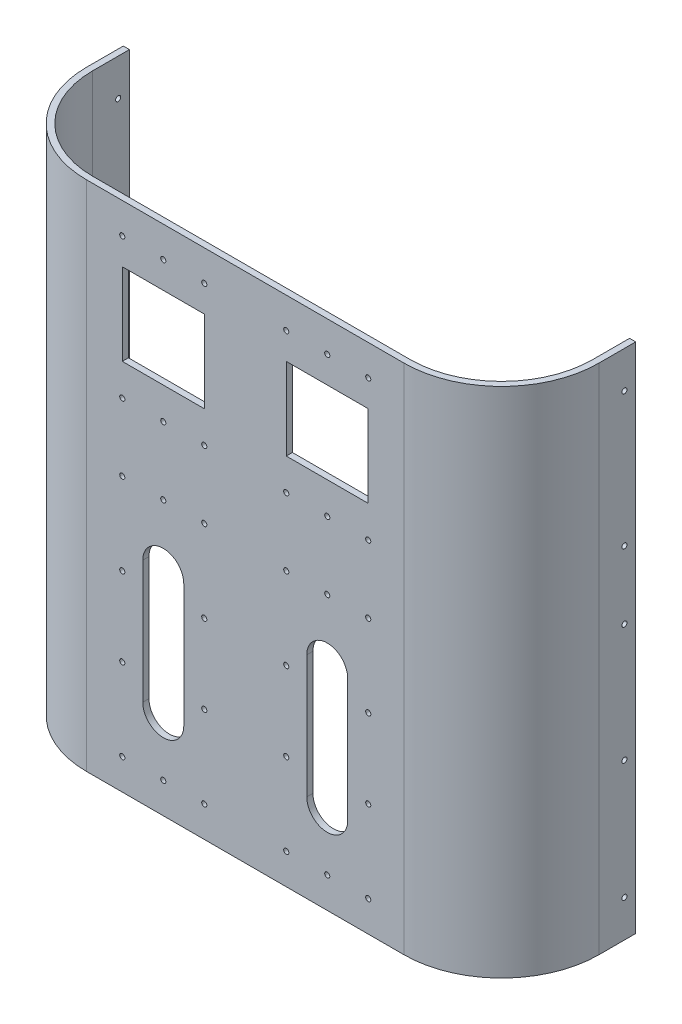
from build123d import *

# Parameters (mm, degrees)
SKETCH_1_W                  = 250
SKETCH_1_H                  = 250
EXTRUDE_1_DEPTH             = 65.5
SKETCH_2_W                  = 244
SKETCH_2_H                  = 62.5
CUT_EXTRUDE_1_DEPTH         = 286.161796179
SKETCH_3_W                  = 40
SKETCH_3_H                  = 40
CUT_EXTRUDE_2_DEPTH         = 287.410980935
CUT_EXTRUDE_3_DEPTH         = 287.410980935
SKETCH_5_W                  = 40
SKETCH_5_H                  = 40
CUT_EXTRUDE_4_DEPTH         = 287.410980935
CUT_EXTRUDE_5_DEPTH         = 288.080563605
HOLE_WIZARD_2_5_2_5_1_D     = 2.5
HOLE_WIZARD_2_5_2_5_2_D     = 2.5
HOLE_WIZARD_2_5_2_5_2_DEPTH = 3
HOLE_WIZARD_2_5_2_5_3_D     = 2.5
FILLET_1_R                  = 44.5
FILLET_2_R                  = 47.5


with BuildPart() as part:
    # Эскиз1 → Бобышка-Вытянуть1 (new body)
    with BuildSketch(Plane.XY.offset(56.5)):
        with Locations((0, 125)):
            Rectangle(SKETCH_1_W, SKETCH_1_H)
    extrude(amount=-EXTRUDE_1_DEPTH)

    # Эскиз2 → Вырез-Вытянуть1 (cut, through all)
    with BuildSketch(Plane.XZ):
        with Locations((0, 22.25)):
            Rectangle(SKETCH_2_W, SKETCH_2_H)
    extrude(amount=-CUT_EXTRUDE_1_DEPTH, mode=Mode.SUBTRACT)

    # Эскиз3 → Вырез-Вытянуть2 (cut, through all)
    with BuildSketch(Plane(origin=(0, 0, 53.5), x_dir=(-1, 0, 0), z_dir=(0, 0, -1))):
        with Locations((40, 202)):
            Rectangle(SKETCH_3_W, SKETCH_3_H)
    extrude(amount=-CUT_EXTRUDE_2_DEPTH, mode=Mode.SUBTRACT)

    # Эскиз4 → Вырез-Вытянуть3 (cut, through all)
    with BuildSketch(Plane(origin=(0, 0, 53.5), x_dir=(-1, 0, 0), z_dir=(0, 0, -1))):
        with BuildLine():
            Line((-50, 103), (-50, 43))
            ThreePointArc((-50, 43), (-40, 33), (-30, 43))
            Line((-30, 43), (-30, 103))
            ThreePointArc((-30, 103), (-40, 113), (-50, 103))
        make_face()
    extrude(amount=-CUT_EXTRUDE_3_DEPTH, mode=Mode.SUBTRACT)

    # Эскиз5 → Вырез-Вытянуть4 (cut, through all)
    with BuildSketch(Plane(origin=(0, 0, 53.5), x_dir=(-1, 0, 0), z_dir=(0, 0, -1))):
        with Locations((-40, 202)):
            Rectangle(SKETCH_5_W, SKETCH_5_H)
    extrude(amount=-CUT_EXTRUDE_4_DEPTH, mode=Mode.SUBTRACT)

    # Эскиз6 → Вырез-Вытянуть5 (cut, through all)
    with BuildSketch(Plane.XY.offset(56.5)):
        with BuildLine():
            Line((-30, 43), (-30, 103))
            ThreePointArc((-30, 103), (-40, 113), (-50, 103))
            Line((-50, 103), (-50, 43))
            ThreePointArc((-50, 43), (-40, 33), (-30, 43))
        make_face()
    extrude(amount=-CUT_EXTRUDE_5_DEPTH, mode=Mode.SUBTRACT)

    # Диаметр отверстия Ø2.5 (2.5)1 (through all)
    with Locations(Plane(origin=(0, 0, 53.5), x_dir=(-1, 0, 0), z_dir=(0, 0, -1))):
        with Locations((60, 166.5), (20, 235), (20, 166.5), (-20, 133.5), (-20, 15), (-40, 166.5), (-40, 15), (-60, 235), (-60, 166.5), (60, 55), (20, 93.5), (20, 55), (-20, 93.5), (-20, 55), (-60, 93.5), (-60, 55), (60, 93.5), (-60, 15), (-60, 133.5), (-40, 133.5), (-40, 235), (-20, 166.5), (-20, 235), (20, 15), (20, 133.5), (40, 15), (40, 133.5), (40, 166.5), (40, 235), (60, 15), (60, 133.5), (60, 235)):
            Hole(HOLE_WIZARD_2_5_2_5_1_D / 2)

    # Диаметр отверстия Ø2.5 (2.5)2
    with Locations(Plane.ZY.offset(-122)):
        with Locations((-3.5, 232), (-3.5, 18), (-3.5, 76), (-3.5, 133.5), (-3.5, 166.5)):
            Hole(HOLE_WIZARD_2_5_2_5_2_D / 2, depth=HOLE_WIZARD_2_5_2_5_2_DEPTH)

    # Диаметр отверстия Ø2.5 (2.5)3 (through all)
    with Locations(Plane(origin=(-122, 0, 0), x_dir=(0, 0, -1), z_dir=(1, 0, 0))):
        with Locations((3.5, 232), (3.5, 166.5), (3.5, 76), (3.5, 18), (3.5, 133.5)):
            Hole(HOLE_WIZARD_2_5_2_5_3_D / 2)

    # Скругление1
    fillet_1_edges = [part.edges().sort_by_distance(p)[0] for p in [
        (-122, 125, 53.5),
        (122, 125, 53.5),
    ]]
    fillet(fillet_1_edges, radius=FILLET_1_R)

    # Скругление2
    fillet_2_edges = [part.edges().sort_by_distance(p)[0] for p in [
        (125, 125, 56.5),
        (-125, 125, 56.5),
    ]]
    fillet(fillet_2_edges, radius=FILLET_2_R)


solid = part.part
